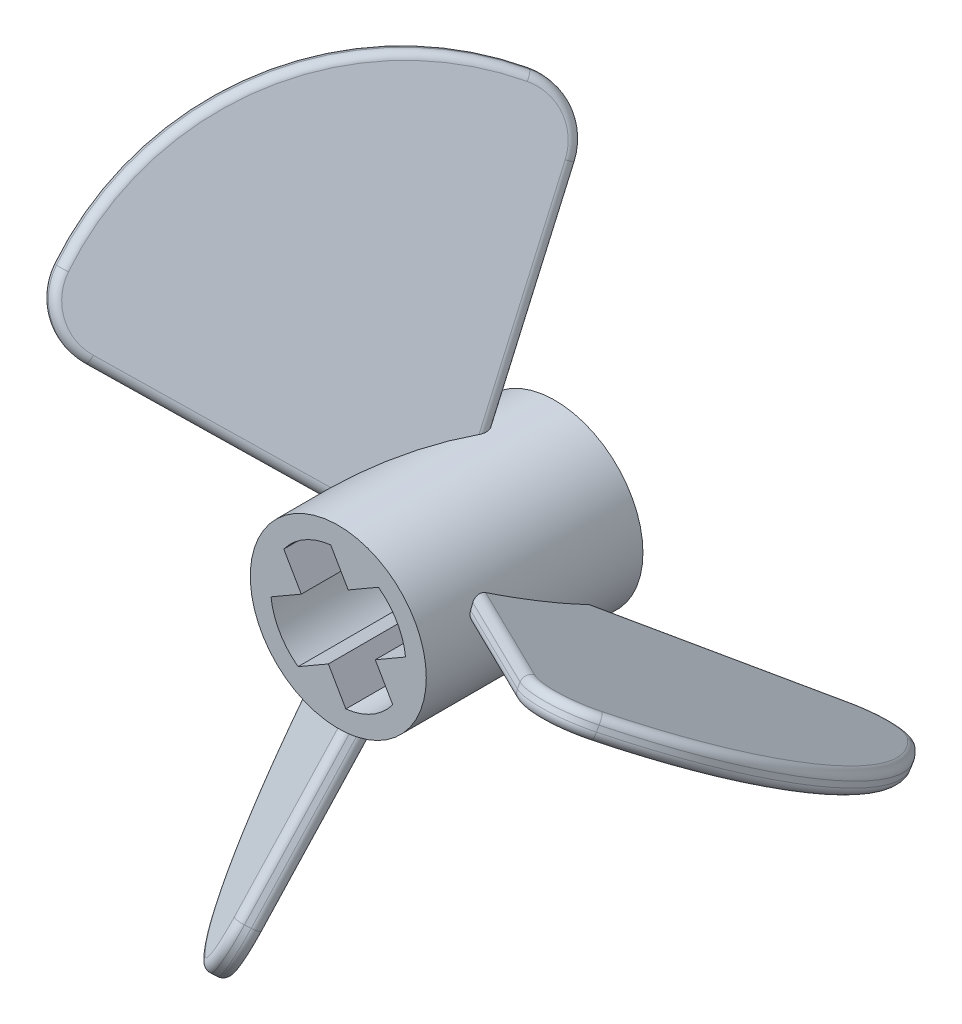
from build123d import *

# Parameters (mm, degrees)
SKETCH1_R                = 3.25
BOSS_EXTRUDE1_DEPTH      = 4
BOSS_EXTRUDE4_DEPTH      = 0.4
FILLET1_R                = 2
CIRPATTERN2_COUNT        = 3
FILLET1_OF_CIRPATTERN2_R = 2
CUT_EXTRUDE1_REACH       = 23.637
FILLET2_R                = 0.3


with BuildPart() as part:
    # Sketch1 → Boss-Extrude1 (new, symmetric)
    with BuildSketch(Plane.XY):
        Circle(SKETCH1_R)
    extrude(amount=BOSS_EXTRUDE1_DEPTH, both=True)

    # Sketch6 → Boss-Extrude4 (add, symmetric)
    with BuildSketch(Plane(origin=(0, 0, 0), x_dir=(-1, 0, 0), z_dir=(0, 0.866025403784438, -0.500000000000001))):
        with BuildLine():
            Line((0, 0), (-10, 8))
            ThreePointArc((-10, 8), (-14, 0), (-10, -8))
            Line((-10, -8), (0, 0))
        make_face()
    boss_extrude4 = extrude(amount=BOSS_EXTRUDE4_DEPTH, both=True)

    # Fillet1
    fillet1_edges = [part.edges().sort_by_distance(p)[0] for p in [
        (10, -4, -6.92820323),
        (10, 4, 6.92820323),
    ]]
    fillet(fillet1_edges, radius=FILLET1_R)

    # CirPattern2: Boss-Extrude4 ×3 about axis
    cirpattern2_axis = Axis((0, 0, 4), (0, 0, -1))
    for i in range(1, CIRPATTERN2_COUNT):
        add(boss_extrude4.rotate(cirpattern2_axis, i * 360 / CIRPATTERN2_COUNT))

    # Fillet1 of CirPattern2
    fillet1_of_cirpattern2_edges = [part.edges().sort_by_distance(p)[0] for p in [
        (-8.464101615, -6.660254038, -6.92820323),
        (-1.535898385, -10.660254038, 6.92820323),
        (-1.535898385, 10.660254038, -6.92820323),
        (-8.464101615, 6.660254038, 6.92820323),
    ]]
    fillet(fillet1_of_cirpattern2_edges, radius=FILLET1_OF_CIRPATTERN2_R)

    # Sketch7 → Cut-Extrude1 (cut, up to next)
    with BuildSketch(Plane.XY.offset(4), mode=Mode.PRIVATE) as cut_extrude1_sk1:
        with BuildLine():
            Line((1.484313483, 2.011669328), (0.366025404, 1.366025404))
            Line((0.366025404, 1.366025404), (-0.27961852, 2.484313483))
            ThreePointArc((-0.27961852, 2.484313483), (-1.25, 2.165063509), (-2.011669328, 1.484313483))
            Line((-2.011669328, 1.484313483), (-1.366025404, 0.366025404))
            Line((-1.366025404, 0.366025404), (-2.484313483, -0.27961852))
            ThreePointArc((-2.484313483, -0.27961852), (-2.165063509, -1.25), (-1.484313483, -2.011669328))
            Line((-1.484313483, -2.011669328), (-0.366025404, -1.366025404))
            Line((-0.366025404, -1.366025404), (0.27961852, -2.484313483))
            ThreePointArc((0.27961852, -2.484313483), (1.25, -2.165063509), (2.011669328, -1.484313483))
            Line((2.011669328, -1.484313483), (1.366025404, -0.366025404))
            Line((1.366025404, -0.366025404), (2.484313483, 0.27961852))
            ThreePointArc((2.484313483, 0.27961852), (2.165063509, 1.25), (1.484313483, 2.011669328))
        make_face()
    cut_extrude1_tool1 = extrude(cut_extrude1_sk1.sketch, amount=-CUT_EXTRUDE1_REACH, mode=Mode.PRIVATE) & part.part
    add(cut_extrude1_tool1.solids().sort_by_distance((0, 0, 4))[0], mode=Mode.SUBTRACT)

    # Fillet2
    fillet2_edges = [part.edges().sort_by_distance(p)[0] for p in [
        (-1.20587358, -6.114217695, 4.286257479),
        (-2.149245107, -10.400789842, 6.583480561),
        (-7.3, -11.951150572, 0.2),
        (-8.532725669, -6.715285621, -6.183480561),
        (-0.587527, -6.333289225, 3.803498858),
        (-1.549245107, -10.747200003, 6.183480561),
        (-6.7, -12.297560734, -0.2),
        (-7.932725669, -7.061695783, -6.583480561),
        (-5.191025858, 3.67545792, 3.803498858),
        (-8.532725669, 6.715285621, 6.183480561),
        (-7.3, 11.951150572, -0.2),
        (-1.20587358, 6.114217695, -4.286257479),
        (-0.587527, 6.333289225, -3.803498858),
        (-4.692131059, 4.101426001, 4.286257479),
        (-7.932725669, 7.061695783, 6.583480561),
        (-6.7, 12.297560734, 0.2),
        (5.778552858, -2.657831305, -3.803498858),
        (10.081970776, -4.031914382, -6.183480561),
        (14, -0.346410162, 0.2),
        (10.081970776, 3.339094059, 6.583480561),
        (5.898004638, -2.012791694, -4.286257479),
        (10.081970776, -3.339094059, -6.583480561),
        (14, 0.346410162, -0.2),
        (10.081970776, 4.031914382, 6.183480561),
        (-5.191025858, -3.67545792, -3.803498858),
        (-4.692131059, -4.101426001, -4.286257479),
        (-2.149245107, 10.400789842, -6.583480561),
        (-1.549245107, 10.747200003, -6.183480561),
        (5.898004638, 2.012791694, 4.286257479),
        (5.778552858, 2.657831305, 3.803498858),
    ]]
    fillet(fillet2_edges, radius=FILLET2_R)


solid = part.part
